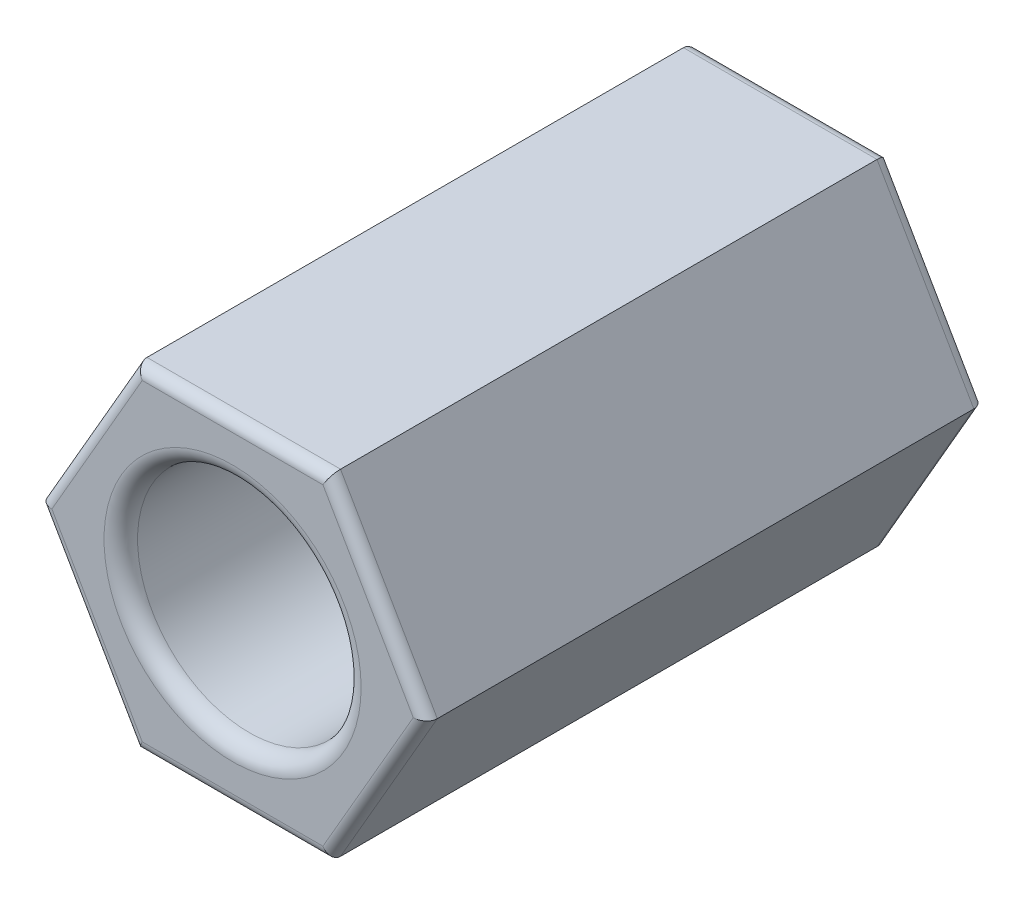
from build123d import *

# Parameters (mm, degrees)
SKETCH1_R           = 2
BOSS_EXTRUDE1_DEPTH = 10
FILLET1_R           = 0.3
FILLET2_R           = 0.2


with BuildPart() as part:
    # Sketch1 → Boss-Extrude1 (new body)
    with BuildSketch(Plane.XY):
        Polygon((3.464101615, 0), (1.732050808, 3), (-1.732050808, 3), (-3.464101615, 0), (-1.732050808, -3), (1.732050808, -3), align=None)
        Circle(SKETCH1_R, mode=Mode.SUBTRACT)
    extrude(amount=BOSS_EXTRUDE1_DEPTH)

    # Fillet1
    fillet1_edges = [part.edges().sort_by_distance(p)[0] for p in [
        (-2, 0, 0),
        (-2, 0, 10),
    ]]
    fillet(fillet1_edges, radius=FILLET1_R)

    # Fillet2
    fillet2_edges = [part.edges().sort_by_distance(p)[0] for p in [
        (-2.598076211, 1.5, 10),
        (-2.598076211, -1.5, 10),
        (0, -3, 10),
        (2.598076211, -1.5, 10),
        (2.598076211, 1.5, 10),
        (0, 3, 10),
        (2.598076211, -1.5, 0),
        (0, -3, 0),
        (-2.598076211, -1.5, 0),
        (-2.598076211, 1.5, 0),
        (0, 3, 0),
        (2.598076211, 1.5, 0),
    ]]
    fillet(fillet2_edges, radius=FILLET2_R)


solid = part.part
